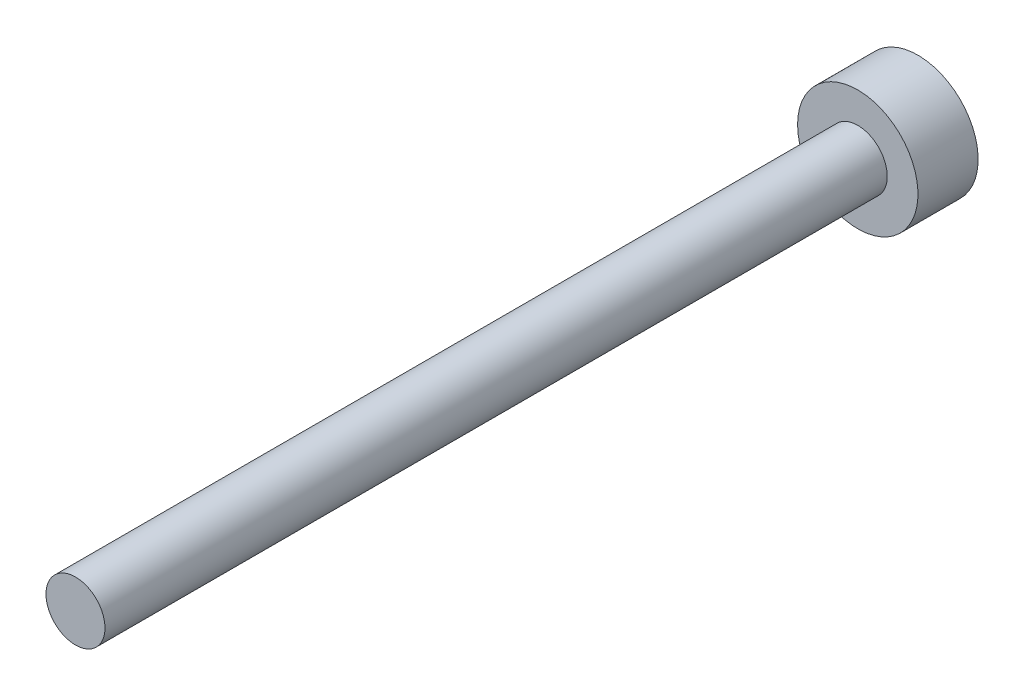
from build123d import *

# Parameters (mm, degrees)
SKETCH_1_R      = 2.45
EXTRUDE_1_DEPTH = 70
SKETCH_2_R      = 5
EXTRUDE_2_DEPTH = 5


with BuildPart() as part:
    # 草图1 → 凸台-拉伸1 (new body)
    with BuildSketch(Plane.XY):
        Circle(SKETCH_1_R)
    extrude(amount=EXTRUDE_1_DEPTH)

    # 草图2 → 凸台-拉伸2 (add)
    with BuildSketch(Plane(origin=(0, 0, 0), x_dir=(-1, 0, 0), z_dir=(0, 0, -1))):
        Circle(SKETCH_2_R)
    extrude(amount=-EXTRUDE_2_DEPTH)


solid = part.part
